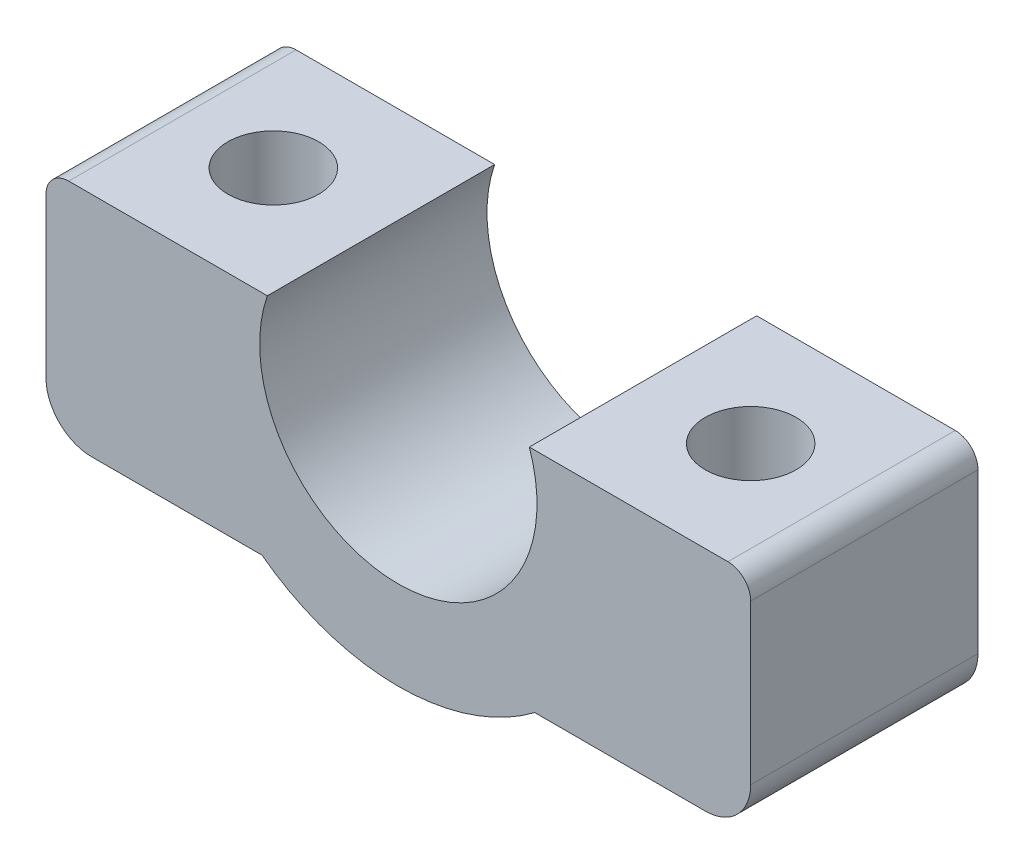
from build123d import *

# Parameters (mm, degrees)
SKETCH_1_R          = 15
EXTRUDE_1_DEPTH     = 10
CUT_EXTRUDE_1_DEPTH = 10
SKETCH_5_R          = 2
CUT_EXTRUDE_2_DEPTH = 25.779023387
SKETCH_7_W          = 30.648506912
SKETCH_7_H          = 10.688803122
CUT_EXTRUDE_4_DEPTH = 24.45207897
EXTRUDE_START       = -10
EXTRUDE_2_DEPTH     = 10
EXTRUDE_3_DEPTH     = 10
FILLET_1_R          = 2
FILLET_2_R          = 1


with BuildPart() as part:
    # ｽｹｯﾁ1 → ﾎﾞｽ - 押し出し1 (new body)
    with BuildSketch(Plane.XY):
        Circle(SKETCH_1_R)
    extrude(amount=EXTRUDE_1_DEPTH)

    # ｽｹｯﾁ2 → ｶｯﾄ - 押し出し1 (cut)
    with BuildSketch(Plane.XY.offset(10)):
        with BuildLine():
            Line((5.762811814, 2), (20.145888179, 2))
            Line((20.145888179, 2), (20.145888179, 26.748934653))
            Line((20.145888179, 26.748934653), (-19.854111821, 26.748934653))
            Line((-19.854111821, 26.748934653), (-19.854111821, 2))
            Line((-19.854111821, 2), (-5.762811814, 2))
            ThreePointArc((-5.762811814, 2), (0, -6.1), (5.762811814, 2))
        make_face()
    extrude(amount=-CUT_EXTRUDE_1_DEPTH, mode=Mode.SUBTRACT)

    # ｽｹｯﾁ5 → ｶｯﾄ - 押し出し2 (cut, through all)
    with BuildSketch(Plane(origin=(0, 2, 0), x_dir=(1, 0, 0), z_dir=(0, 1, 0))):
        with Locations(Location((-10.5, -5, 0), (0, 0, 270))):
            Circle(SKETCH_5_R)
        with Locations(Location((10.5, -5, 0), (0, 0, 270))):
            Circle(SKETCH_5_R)
    extrude(amount=-CUT_EXTRUDE_2_DEPTH, mode=Mode.SUBTRACT)

    # ｽｹｯﾁ7 → ｶｯﾄ - 押し出し4 (cut, through all)
    with BuildSketch(Plane.XY.offset(10)):
        with Locations((0, -13.344401561)):
            Rectangle(SKETCH_7_W, SKETCH_7_H)
    extrude(amount=-CUT_EXTRUDE_4_DEPTH, mode=Mode.SUBTRACT)

    # ｽｹｯﾁ8 → ﾎﾞｽ - 押し出し2 (add)
    with BuildSketch(Plane.XY.offset(10).offset(EXTRUDE_START)):
        with BuildLine():
            Line((-14.866068747, 2), (-15.5, 2))
            Line((-15.5, 2), (-15.5, -8))
            Line((-15.5, -8), (-12.68857754, -8))
            ThreePointArc((-12.68857754, -8), (-14.656555974, -3.191452176), (-14.866068747, 2))
        make_face()
        with BuildLine():
            ThreePointArc((14.866068747, 2), (14.656555974, -3.191452176), (12.68857754, -8))
            Line((12.68857754, -8), (15.5, -8))
            Line((15.5, -8), (15.5, 2))
            Line((15.5, 2), (14.866068747, 2))
        make_face()
    extrude(amount=EXTRUDE_2_DEPTH)

    # ｽｹｯﾁ9 → ﾎﾞｽ - 押し出し3 (add)
    with BuildSketch(Plane.XY.offset(10)):
        with BuildLine():
            Line((-6, -8), (6, -8))
            ThreePointArc((6, -8), (0, -10), (-6, -8))
        make_face()
    extrude(amount=-EXTRUDE_3_DEPTH)

    # ﾌｨﾚｯﾄ1
    fillet_1_edges = [part.edges().sort_by_distance(p)[0] for p in [
        (-15.5, -8, 5),
        (15.5, -8, 5),
    ]]
    fillet(fillet_1_edges, radius=FILLET_1_R)

    # ﾌｨﾚｯﾄ2
    fillet_2_edges = [part.edges().sort_by_distance(p)[0] for p in [
        (-15.5, 2, 5),
        (15.5, 2, 5),
    ]]
    fillet(fillet_2_edges, radius=FILLET_2_R)


solid = part.part
